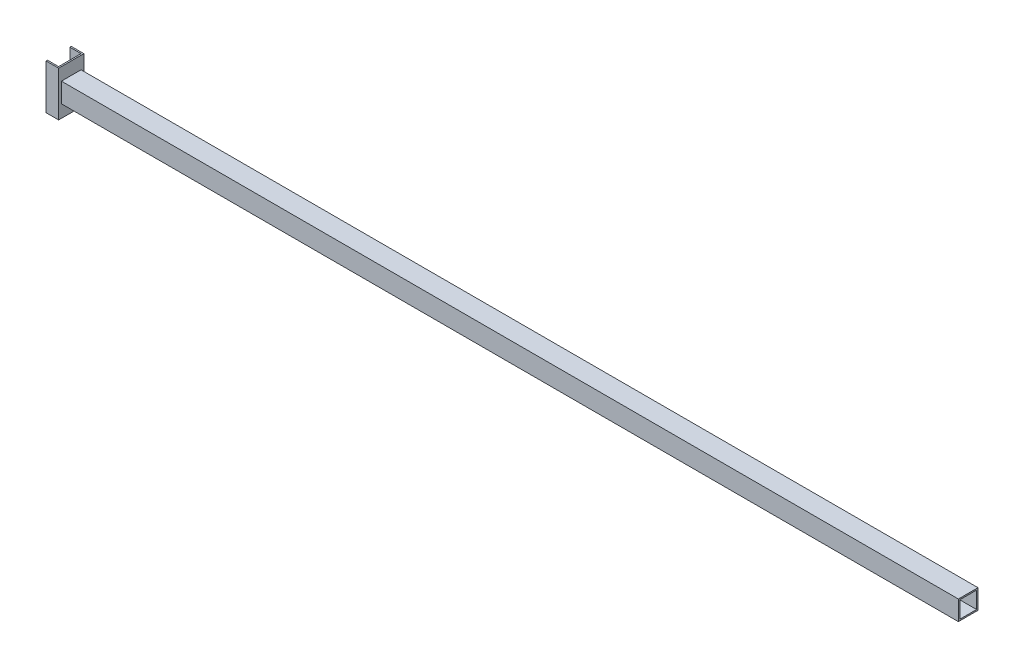
from build123d import *

# Parameters (mm, degrees)
SKETCH1_W           = 28.575
SKETCH1_H           = 50.8
BOSS_EXTRUDE1_DEPTH = 1.5875
SKETCH1_3_W         = 1.5875
SKETCH1_3_H         = 50.8
BOSS_EXTRUDE2_DEPTH = 14.2875
SKETCH1_4_W         = 22.225
SKETCH1_4_H         = 22.225
SKETCH1_4_W_2       = 19.05
SKETCH1_4_H_2       = 19.05
BOSS_EXTRUDE3_DEPTH = 1016
BOSS_EXTRUDE4_DEPTH = 12.7
LPATTERN1_COUNT     = 2
LPATTERN1_PITCH     = 25.4


with BuildPart() as part:
    # Sketch1 → Boss-Extrude1 (new body)
    with BuildSketch(Plane(origin=(0, 0, 0), x_dir=(0, 0, -1), z_dir=(1, 0, 0))):
        Rectangle(SKETCH1_W, SKETCH1_H)
    extrude(amount=-BOSS_EXTRUDE1_DEPTH)

    # Sketch1<3> → Boss-Extrude2 (add)
    with BuildSketch(Plane(origin=(0, 0, 0), x_dir=(0, 0, -1), z_dir=(1, 0, 0))):
        with Locations((-13.49375, 0)):
            Rectangle(SKETCH1_3_W, SKETCH1_3_H)
        with Locations((13.49375, 0)):
            Rectangle(SKETCH1_3_W, SKETCH1_3_H)
    extrude(amount=-BOSS_EXTRUDE2_DEPTH)

    # Sketch1<4> → Boss-Extrude3 (add)
    with BuildSketch(Plane(origin=(0, 0, 0), x_dir=(0, 0, -1), z_dir=(1, 0, 0))):
        Rectangle(SKETCH1_4_W, SKETCH1_4_H)
        Rectangle(SKETCH1_4_W_2, SKETCH1_4_H_2, mode=Mode.SUBTRACT)
    extrude(amount=BOSS_EXTRUDE3_DEPTH)

    # 3DSketch1 → Boss-Extrude4 (add)
    with BuildSketch(Plane(origin=(-1.5875, 12.7, -6.35), x_dir=(0, 1, 0), z_dir=(0, 0, 1))):
        Polygon((0, 0), (0, 3.175), (6.35, 0), align=None)
    boss_extrude4 = extrude(amount=BOSS_EXTRUDE4_DEPTH)

    # LPattern1: Boss-Extrude4 ×2
    with Locations(*[(0, -i * LPATTERN1_PITCH, 0) for i in range(1, LPATTERN1_COUNT)]):
        add(boss_extrude4)


solid = part.part
